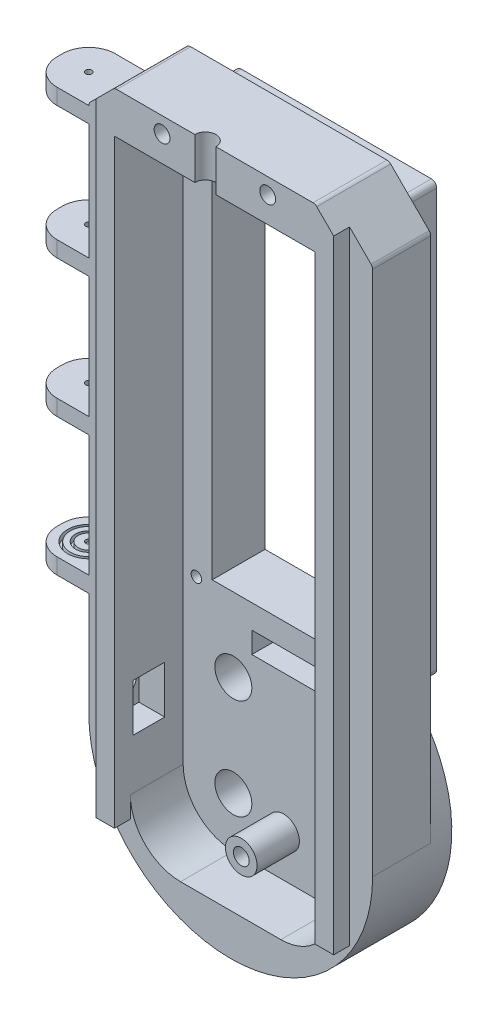
from build123d import *

# Parameters (mm, degrees)
CROQUIS1_W               = 38
CROQUIS1_H               = 81
CROQUIS1_W_2             = 27
CROQUIS1_H_2             = 72
CROQUIS1_H_3             = 38
CROQUIS1_R               = 3.5
SALIENTE_EXTRUIR1_DEPTH  = 5
CROQUIS2_W               = 38
CROQUIS2_H               = 81
CROQUIS2_W_2             = 27
CROQUIS2_H_2             = 72
SALIENTE_EXTRUIR2_DEPTH  = 5
SALIENTE_EXTRUIR9_START  = -1
SALIENTE_EXTRUIR9_DEPTH  = 1
SALIENTE_EXTRUIR10_DEPTH = 11
SALIENTE_EXTRUIR11_DEPTH = 10
REDONDEO1_R              = 1
REDONDEO2_R              = 1
REDONDEO3_R              = 1
CROQUIS6_W               = 6
CROQUIS6_H               = 9
CORTAR_EXTRUIR1_DEPTH    = 8
CROQUIS7_W               = 6
CROQUIS7_H               = 9
CROQUIS7_R               = 2.5
SALIENTE_EXTRUIR12_DEPTH = 3
SALIENTE_EXTRUIR13_DEPTH = 11
REDONDEO4_R              = 5
CROQUIS9_R               = 0.6
CORTAR_EXTRUIR2_DEPTH    = 80
SALIENTE_EXTRUIR14_START = -2.5
CROQUIS10_R              = 0.6
SALIENTE_EXTRUIR14_DEPTH = 2.5
CROQUIS11_R              = 4
CROQUIS11_R_2            = 3.5
CROQUIS11_R_3            = 2.5
CROQUIS11_R_4            = 2
CORTAR_EXTRUIR3_DEPTH    = 1
SALIENTE_EXTRUIR15_DEPTH = 3
CROQUIS14_R              = 1.5
CORTAR_EXTRUIR4_DEPTH    = 14
CROQUIS16_W              = 3.5
CROQUIS16_H              = 3
SALIENTE_EXTRUIR16_DEPTH = 4
CROQUIS25_R              = 3
CROQUIS25_R_2            = 1.5
SALIENTE_EXTRUIR21_DEPTH = 18
CROQUIS26_R              = 1.5
CORTAR_EXTRUIR7_DEPTH    = 18
CROQUIS28_R              = 1
CORTAR_EXTRUIR8_DEPTH    = 4
CROQUIS29_R              = 3
CROQUIS29_R_2            = 1.5
CORTAR_EXTRUIR9_DEPTH    = 5
CROQUIS31_W              = 16
CROQUIS31_H              = 4
CORTAR_EXTRUIR10_DEPTH   = 5


with BuildPart() as part:
    # Croquis1 → Saliente-Extruir1 (new body)
    # profile 1 of 5: a face of its own
    with BuildSketch(Plane.XY):
        Rectangle(CROQUIS1_W, CROQUIS1_H)
        Rectangle(CROQUIS1_W_2, CROQUIS1_H_2, mode=Mode.SUBTRACT)
    # profile 2 of 5: a face of its own
    with BuildSketch(Plane.XY):
        with Locations((0, -59.5)):
            Rectangle(CROQUIS1_W, CROQUIS1_H_3)
        with Locations((-9.5, -69)):
            Circle(CROQUIS1_R, mode=Mode.SUBTRACT)
        with Locations((9.5, -59.5)):
            Circle(CROQUIS1_R, mode=Mode.SUBTRACT)
        with Locations((-9.5, -50)):
            Circle(CROQUIS1_R, mode=Mode.SUBTRACT)
    # profile 3 of 5: a face of its own
    with BuildSketch(Plane.XY):
        with BuildLine():
            ThreePointArc((19, -78.5), (26.870057685, -59.5), (19, -40.5))
            Line((19, -40.5), (19, -78.5))
        make_face()
    # profile 4 of 5: a face of its own
    with BuildSketch(Plane.XY):
        with BuildLine():
            Line((19, -78.5), (-19, -78.5))
            ThreePointArc((-19, -78.5), (0, -86.370057685), (19, -78.5))
        make_face()
    # profile 5 of 5: a face of its own
    with BuildSketch(Plane.XY):
        with BuildLine():
            Line((-19, -78.5), (-19, -40.5))
            ThreePointArc((-19, -40.5), (-26.870057685, -59.5), (-19, -78.5))
        make_face()
    extrude(amount=SALIENTE_EXTRUIR1_DEPTH)

    # Croquis2 → Saliente-Extruir2 (add)
    with BuildSketch(Plane(origin=(0, 0, 0), x_dir=(-1, 0, 0), z_dir=(0, 0, -1))):
        Rectangle(CROQUIS2_W, CROQUIS2_H)
        Rectangle(CROQUIS2_W_2, CROQUIS2_H_2, mode=Mode.SUBTRACT)
    extrude(amount=SALIENTE_EXTRUIR2_DEPTH)

    # Croquis3 → Saliente-Extruir9 (add)
    with BuildSketch(Plane.XY.offset(5).offset(SALIENTE_EXTRUIR9_START)):
        with BuildLine():
            Line((26.870057685, -59.5), (26.870057685, 40.5))
            Line((26.870057685, 40.5), (19, 48.370057685))
            Line((19, 48.370057685), (-19, 48.370057685))
            Line((-19, 48.370057685), (-26.870057685, 40.5))
            Line((-26.870057685, 40.5), (-26.870057685, -59.5))
            ThreePointArc((-26.870057685, -59.5), (0, -86.370057685), (26.870057685, -59.5))
        make_face()
        with BuildLine():
            Line((19, -59.5), (19, 40.5))
            Line((19, 40.5), (-19, 40.5))
            Line((-19, 40.5), (-19, -59.5))
            ThreePointArc((-19, -59.5), (0, -78.5), (19, -59.5))
        make_face(mode=Mode.SUBTRACT)
    extrude(amount=SALIENTE_EXTRUIR9_DEPTH)

    # Croquis4 → Saliente-Extruir10 (add)
    with BuildSketch(Plane(origin=(0, 0, 4), x_dir=(-1, 0, 0), z_dir=(0, 0, -1))):
        with BuildLine():
            Line((19, 40.5), (19, -40.5))
            ThreePointArc((19, -40.5), (24.824696333, -49.217274097), (26.870057685, -59.5))
            Line((26.870057685, -59.5), (26.870057685, 40.5))
            Line((26.870057685, 40.5), (19, 48.370057685))
            Line((19, 48.370057685), (-19, 48.370057685))
            Line((-19, 48.370057685), (-26.870057685, 40.5))
            Line((-26.870057685, 40.5), (-26.870057685, -59.5))
            ThreePointArc((-26.870057685, -59.5), (-24.824696333, -49.217274097), (-19, -40.5))
            Line((-19, -40.5), (-19, 40.5))
            Line((-19, 40.5), (19, 40.5))
        make_face()
    extrude(amount=-SALIENTE_EXTRUIR10_DEPTH)

    # Croquis5 → Saliente-Extruir11 (add)
    with BuildSketch(Plane.XY.offset(5)):
        with BuildLine():
            Line((-19, -59.5), (-19, -69))
            ThreePointArc((-19, -69), (-16.217514421, -75.717514421), (-9.5, -78.5))
            Line((-9.5, -78.5), (9.5, -78.5))
            ThreePointArc((9.5, -78.5), (16.217514421, -75.717514421), (19, -69))
            Line((19, -69), (19, -59.5))
            Line((19, -59.5), (19, -40.5))
            ThreePointArc((19, -40.5), (0, -86.370057685), (-19, -40.5))
            Line((-19, -40.5), (-19, -59.5))
        make_face()
    extrude(amount=SALIENTE_EXTRUIR11_DEPTH)

    # Redondeo1
    redondeo1_edges = [part.edges().sort_by_distance(p)[0] for p in [
        (19, -40.5, -2.5),
        (-19, -40.5, -2.5),
        (19, 40.5, -0.5),
        (-19, 40.5, -0.5),
    ]]
    fillet(redondeo1_edges, radius=REDONDEO1_R)

    # Redondeo2
    redondeo2_edges = [part.edges().sort_by_distance(p)[0] for p in [
        (-19, -0.5, 4),
        (0, 40.5, 4),
        (-18.707106781, 40.207106781, 4),
        (18.707106781, 40.207106781, 4),
        (19, -0.5, 4),
    ]]
    fillet(redondeo2_edges, radius=REDONDEO2_R)

    # Redondeo3
    redondeo3_edges = [part.edges().sort_by_distance(p)[0] for p in [
        (19, 48.370057685, 9.5),
        (26.870057685, 40.5, 9.5),
        (-26.870057685, 40.5, 9.5),
        (-19, 48.370057685, 9.5),
    ]]
    fillet(redondeo3_edges, radius=REDONDEO3_R)

    # Croquis6 → Cortar-Extruir1 (cut)
    with BuildSketch(Plane.ZY.offset(26.870057685)):
        with Locations((11.5, -55)):
            Rectangle(CROQUIS6_W, CROQUIS6_H)
    extrude(amount=-CORTAR_EXTRUIR1_DEPTH, mode=Mode.SUBTRACT)

    # Croquis7 → Saliente-Extruir12 (add)
    with BuildSketch(Plane.ZY.offset(26.870057685)):
        with Locations((11.5, -55)):
            Rectangle(CROQUIS7_W, CROQUIS7_H)
        with Locations((11.5, -55)):
            Circle(CROQUIS7_R, mode=Mode.SUBTRACT)
    extrude(amount=-SALIENTE_EXTRUIR12_DEPTH)

    # Croquis8 → Saliente-Extruir13 (add)
    with BuildSketch(Plane.ZY.offset(26.870057685)):
        Polygon((15, 40.085786438), (4, 40.085786438), (4, 37.085786438), (9.5, 37.085786438), (15, 37.085786438), align=None)
        Polygon((9.5, 15.085786438), (4, 15.085786438), (4, 12.085786438), (9.5, 12.085786438), (15, 12.085786438), (15, 15.085786438), align=None)
        Polygon((9.5, -10.914213562), (4, -10.914213562), (4, -13.914213562), (9.5, -13.914213562), (15, -13.914213562), (15, -10.914213562), align=None)
        Polygon((9.5, -36.914213562), (4, -36.914213562), (4, -39.914213562), (15, -39.914213562), (15, -36.914213562), align=None)
    extrude(amount=SALIENTE_EXTRUIR13_DEPTH)

    # Redondeo4
    redondeo4_edges = [part.edges().sort_by_distance(p)[0] for p in [
        (-37.870057685, 38.585786438, 4),
        (-37.870057685, 38.585786438, 15),
        (-37.870057685, 13.585786438, 4),
        (-37.870057685, 13.585786438, 15),
        (-37.870057685, -12.414213562, 4),
        (-37.870057685, -12.414213562, 15),
        (-37.870057685, -38.414213562, 4),
        (-37.870057685, -38.414213562, 15),
    ]]
    fillet(redondeo4_edges, radius=REDONDEO4_R)

    # Croquis9 → Cortar-Extruir2 (cut)
    with BuildSketch(Plane(origin=(0, 40.085786438, 0), x_dir=(1, 0, 0), z_dir=(0, 1, 0))):
        with Locations(Location((-32.370057685, -9.5, 0), (0, 0, 270))):
            Circle(CROQUIS9_R)
    extrude(amount=-CORTAR_EXTRUIR2_DEPTH, mode=Mode.SUBTRACT)

    # Croquis10 → Saliente-Extruir14 (add)
    with BuildSketch(Plane.XZ.offset(39.914213562).offset(SALIENTE_EXTRUIR14_START)):
        with Locations(Location((-32.370057685, 9.5, 0), (0, 0, 90))):
            Circle(CROQUIS10_R)
    extrude(amount=SALIENTE_EXTRUIR14_DEPTH)

    # Croquis11 → Cortar-Extruir3 (cut)
    # profile 1 of 2: a face of its own
    with BuildSketch(Plane(origin=(0, -36.914213562, 0), x_dir=(1, 0, 0), z_dir=(0, 1, 0))):
        with Locations(Location((-32.370057685, -9.5, 0), (0, 0, 270))):
            Circle(CROQUIS11_R)
        with Locations(Location((-32.370057685, -9.5, 0), (0, 0, 270))):
            Circle(CROQUIS11_R_2, mode=Mode.SUBTRACT)
    # profile 2 of 2: a face of its own
    with BuildSketch(Plane(origin=(0, -36.914213562, 0), x_dir=(1, 0, 0), z_dir=(0, 1, 0))):
        with Locations(Location((-32.370057685, -9.5, 0), (0, 0, 270))):
            Circle(CROQUIS11_R_3)
        with Locations(Location((-32.370057685, -9.5, 0), (0, 0, 270))):
            Circle(CROQUIS11_R_4, mode=Mode.SUBTRACT)
    extrude(amount=-CORTAR_EXTRUIR3_DEPTH, mode=Mode.SUBTRACT)

    # Croquis13 → Saliente-Extruir15 (add)
    with BuildSketch(Plane.XY.offset(15)):
        Polygon((-19, -65.5), (-19, 40.5), (-22.5, 40.5), (-22.5, -69), (-19, -69), align=None)
        Polygon((22.5, 40.5), (19, 40.5), (19, -65.5), (19, -69), (22.5, -69), align=None)
        with BuildLine():
            Line((-19, 40.5), (19, 40.5))
            Line((19, 40.5), (22.5, 40.5))
            Line((22.5, 40.5), (22.5, 44.870057685))
            Line((22.5, 44.870057685), (19.292893219, 48.077164466))
            ThreePointArc((19.292893219, 48.077164466), (18.96846987, 48.293937218), (18.585786438, 48.370057685))
            Line((18.585786438, 48.370057685), (-18.585786438, 48.370057685))
            ThreePointArc((-18.585786438, 48.370057685), (-18.96846987, 48.293937218), (-19.292893219, 48.077164466))
            Line((-19.292893219, 48.077164466), (-22.5, 44.870057685))
            Line((-22.5, 44.870057685), (-22.5, 40.5))
            Line((-22.5, 40.5), (-19, 40.5))
        make_face()
    extrude(amount=SALIENTE_EXTRUIR15_DEPTH)

    # Croquis14 → Cortar-Extruir4 (cut)
    with BuildSketch(Plane(origin=(0, 0, 4), x_dir=(-1, 0, 0), z_dir=(0, 0, -1))):
        with Locations((10, 45.370057685)):
            Circle(CROQUIS14_R)
        with Locations(Location((-10, 45.370057685, 0), (0, 0, 180))):
            Circle(CROQUIS14_R)
    extrude(amount=-CORTAR_EXTRUIR4_DEPTH, mode=Mode.SUBTRACT)

    # Croquis16 → Saliente-Extruir16 (add)
    with BuildSketch(Plane(origin=(0, -69, 0), x_dir=(-1, 0, 0), z_dir=(0, -1, 0))):
        with Locations((20.75, -16.5)):
            Rectangle(CROQUIS16_W, CROQUIS16_H)
        with Locations((-20.75, -16.5)):
            Rectangle(CROQUIS16_W, CROQUIS16_H)
    extrude(amount=SALIENTE_EXTRUIR16_DEPTH)

    # Croquis25 → Saliente-Extruir21 (add)
    with BuildSketch(Plane.XY.offset(18)):
        with Locations((0, -70.629942315)):
            Circle(CROQUIS25_R)
        with Locations((0, -70.629942315)):
            Circle(CROQUIS25_R_2, mode=Mode.SUBTRACT)
    extrude(amount=-SALIENTE_EXTRUIR21_DEPTH)

    # Croquis26 → Cortar-Extruir7 (cut)
    with BuildSketch(Plane.XY.offset(18)):
        with Locations((0, -70.629942315)):
            Circle(CROQUIS26_R)
    extrude(amount=-CORTAR_EXTRUIR7_DEPTH, mode=Mode.SUBTRACT)

    # Croquis28 → Cortar-Extruir8 (cut)
    with BuildSketch(Plane.XY.offset(5)):
        with Locations((-16.5, 38)):
            Circle(CROQUIS28_R)
        with Locations((14.5, 38)):
            Circle(CROQUIS28_R)
        with Locations((14.5, -37)):
            Circle(CROQUIS28_R)
        with Locations((-16.5, -37)):
            Circle(CROQUIS28_R)
    extrude(amount=-CORTAR_EXTRUIR8_DEPTH, mode=Mode.SUBTRACT)

    # Croquis29 → Cortar-Extruir9 (cut)
    with BuildSketch(Plane.XY.offset(18)):
        with Locations((0, -70.629942315)):
            Circle(CROQUIS29_R)
        with Locations((0, -70.629942315)):
            Circle(CROQUIS29_R_2, mode=Mode.SUBTRACT)
    extrude(amount=-CORTAR_EXTRUIR9_DEPTH, mode=Mode.SUBTRACT)

    # Croquis30 → Cortar-Revolución1 (revolve, cut)
    with BuildSketch(Plane.XY.offset(18)):
        Polygon((-1.8, 45.370057685), (-1.8, 40.5), (0.2, 40.5), (0.2, 48.370057685), (-1.8, 48.370057685), align=None)
    revolve(axis=Axis((-1.8, 45.370057685, 18), (0, -1, 0)), mode=Mode.SUBTRACT)

    # Croquis31 → Cortar-Extruir10 (cut)
    with BuildSketch(Plane.XY.offset(5)):
        with Locations((2, -42.5)):
            Rectangle(CROQUIS31_W, CROQUIS31_H)
    extrude(amount=-CORTAR_EXTRUIR10_DEPTH, mode=Mode.SUBTRACT)


solid = part.part
